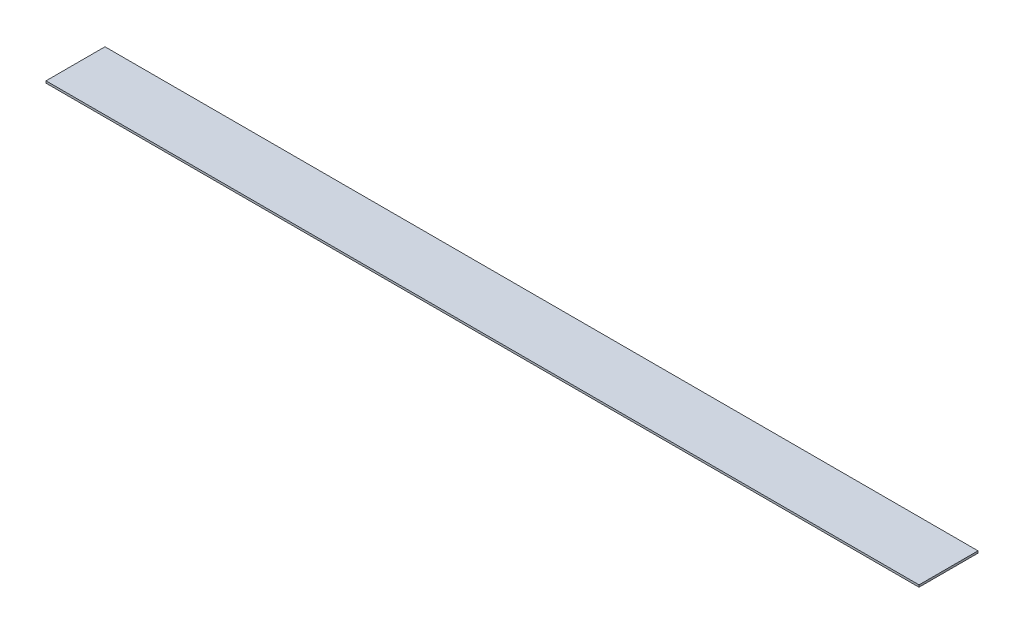
from build123d import *

# Parameters (mm, degrees)
SKETCH1_R           = 3.8
BOSS_EXTRUDE1_DEPTH = 0.9
SKETCH2_W           = 25.6
SKETCH2_H           = 0.9
CUT_EXTRUDE1_DEPTH  = 101


with BuildPart() as part:
    # Sketch1 → Boss-Extrude1 (new body)
    with BuildSketch(Plane(origin=(0, 0, 0), x_dir=(1, 0, 0), z_dir=(0, 1, 0))):
        with BuildLine():
            Line((-240, 12.8), (-240, -12.8))
            Line((-240, -12.8), (234.7, -12.8))
            ThreePointArc((234.7, -12.8), (238.622610201, -6.926940161), (240, 0))
            ThreePointArc((240, 0), (238.622610201, 6.926940161), (234.7, 12.8))
            Line((234.7, 12.8), (-240, 12.8))
        make_face()
        with Locations(Location((230.9, 0, 0), (0, 0, 270))):
            Circle(SKETCH1_R, mode=Mode.SUBTRACT)
    extrude(amount=BOSS_EXTRUDE1_DEPTH)

    # Sketch2 → Cut-Extrude1 (cut)
    with BuildSketch(Plane(origin=(240, 0, 0), x_dir=(0, 0, -1), z_dir=(1, 0, 0))):
        with Locations((0, 0.45)):
            Rectangle(SKETCH2_W, SKETCH2_H)
    extrude(amount=-CUT_EXTRUDE1_DEPTH, mode=Mode.SUBTRACT)


solid = part.part
